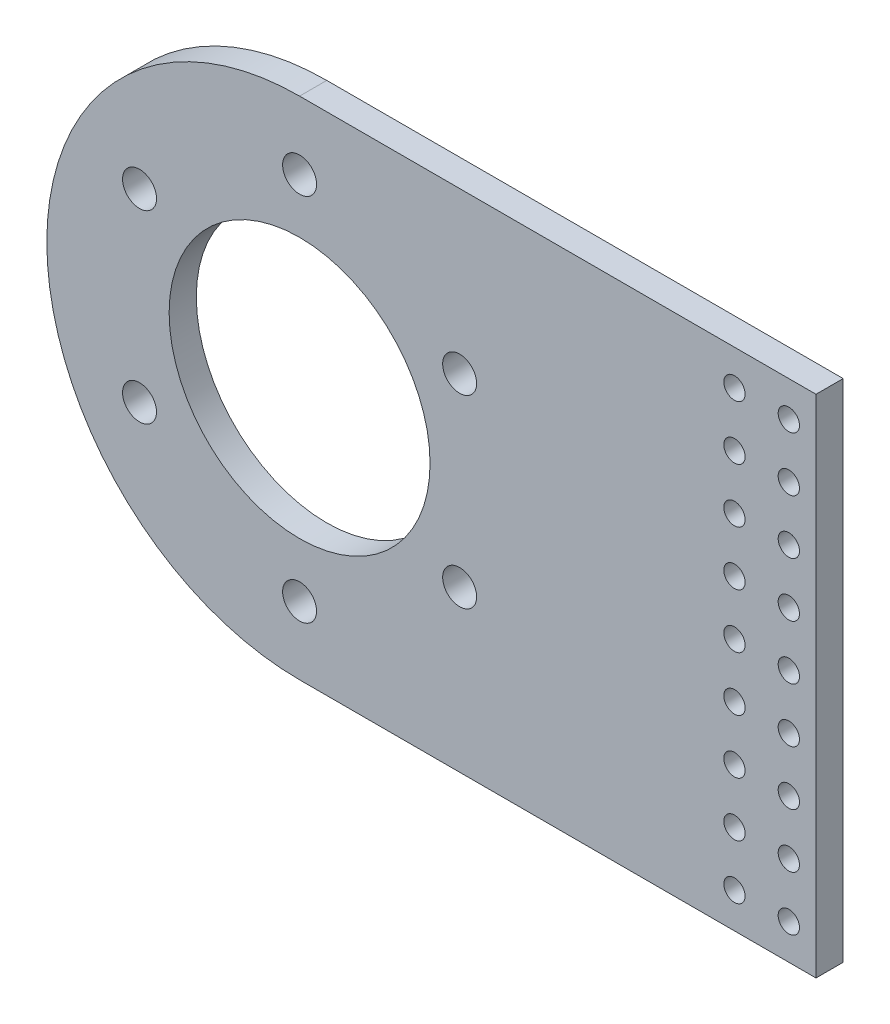
from build123d import *

# Parameters (mm, degrees)
SKETCH1_R                      = 30.48
BOSS_EXTRUDE1_DEPTH            = 6.35
F_9_0_196_DIAMETER_HOLE1_D     = 4.9784
F_5_16_0_3125_DIAMETER_HOLE1_D = 7.9375


with BuildPart() as part:
    # Sketch1 → Boss-Extrude1 (new body)
    with BuildSketch(Plane(origin=(0, 0, 0), x_dir=(0, 1, 0), z_dir=(0, 0, 1))):
        with BuildLine():
            Line((-59.055, 0), (-59.055, -120.65))
            Line((-59.055, -120.65), (59.055, -120.65))
            Line((59.055, -120.65), (59.055, 0))
            ThreePointArc((59.055, 0), (0, 59.055), (-59.055, 0))
        make_face()
        with Locations(Location((0, 0, 0), (0, 0, 270))):
            Circle(SKETCH1_R, mode=Mode.SUBTRACT)
    extrude(amount=BOSS_EXTRUDE1_DEPTH)

    # #9 (0.196) Diameter Hole1 (through all)
    with Locations(Plane.XY.offset(6.35)):
        with Locations((114.3, -50.8), (101.6, -50.8), (101.6, -38.1), (101.6, -25.4), (101.6, -12.7), (101.6, 0), (101.6, 12.7), (101.6, 25.4), (101.6, 38.1), (101.6, 50.8), (114.3, -38.1), (114.3, -25.4), (114.3, -12.7), (114.3, 0), (114.3, 12.7), (114.3, 25.4), (114.3, 38.1), (114.3, 50.8)):
            Hole(F_9_0_196_DIAMETER_HOLE1_D / 2)

    # 5/16 (0.3125) Diameter Hole1 (through all)
    with Locations(Plane.XY.offset(6.35)):
        with Locations((37.394976935, 21.59), (37.394976935, -21.59), (0, -43.18), (-37.394976935, -21.59), (-37.394976935, 21.59), (0, 43.18)):
            Hole(F_5_16_0_3125_DIAMETER_HOLE1_D / 2)


solid = part.part
